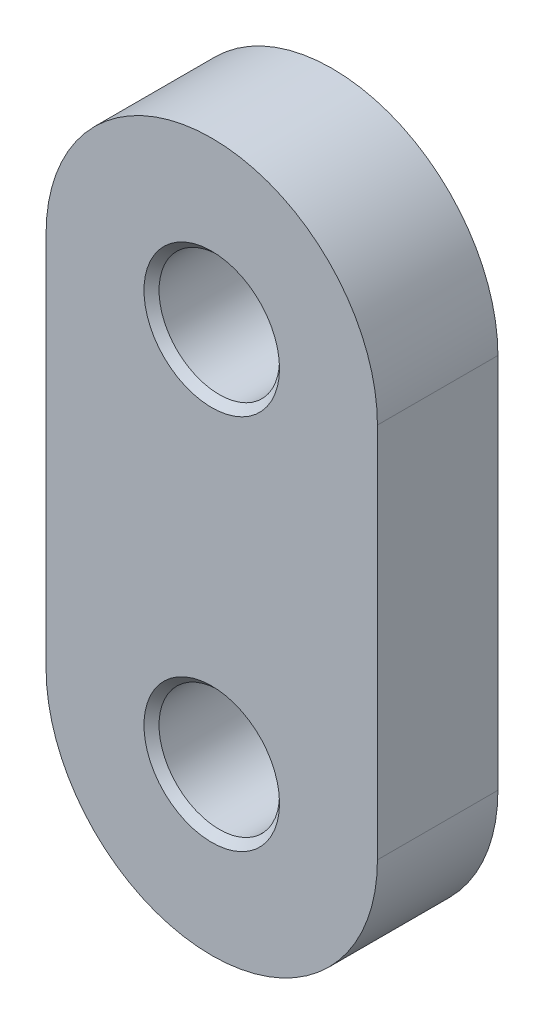
from build123d import *

# Parameters (mm, degrees)
BASE_EXTRUSION_DEPTH    = 8
ESQUISSE2_R             = 4
ENL_V_MAT_EXTRU_1_DEPTH = 39.48376281
ESQUISSE3_R             = 4
ENL_V_MAT_EXTRU_2_DEPTH = 37.545825061
CHANFREIN1_SIZE         = 0.5


with BuildPart() as part:
    # Esquisse1 → Base-Extrusion (new body)
    with BuildSketch(Plane.XY):
        with BuildLine():
            Line((-11, 0), (-11, -25))
            ThreePointArc((-11, -25), (0, -36), (11, -25))
            Line((11, -25), (11, 0))
            ThreePointArc((11, 0), (0, 11), (-11, 0))
        make_face()
    extrude(amount=BASE_EXTRUSION_DEPTH)

    # Esquisse2 → Enlèv. mat.-Extru.1 (cut, through all)
    with BuildSketch(Plane.XY.offset(8)):
        Circle(ESQUISSE2_R)
    extrude(amount=-ENL_V_MAT_EXTRU_1_DEPTH, mode=Mode.SUBTRACT)

    # Esquisse3 → Enlèv. mat.-Extru.2 (cut, through all)
    with BuildSketch(Plane(origin=(-1.490572535, -22.400343219, 8), x_dir=(1, 0, 0), z_dir=(0, 0, 1))):
        with Locations((1.490572535, -2.599656781)):
            Circle(ESQUISSE3_R)
    extrude(amount=-ENL_V_MAT_EXTRU_2_DEPTH, mode=Mode.SUBTRACT)

    # Chanfrein1
    chanfrein1_edges = [part.edges().sort_by_distance(p)[0] for p in [
        (-4, 0, 0),
        (-4, 0, 8),
        (-4, -25, 0),
        (-4, -25, 8),
    ]]
    chamfer(chanfrein1_edges, length=CHANFREIN1_SIZE)


solid = part.part
